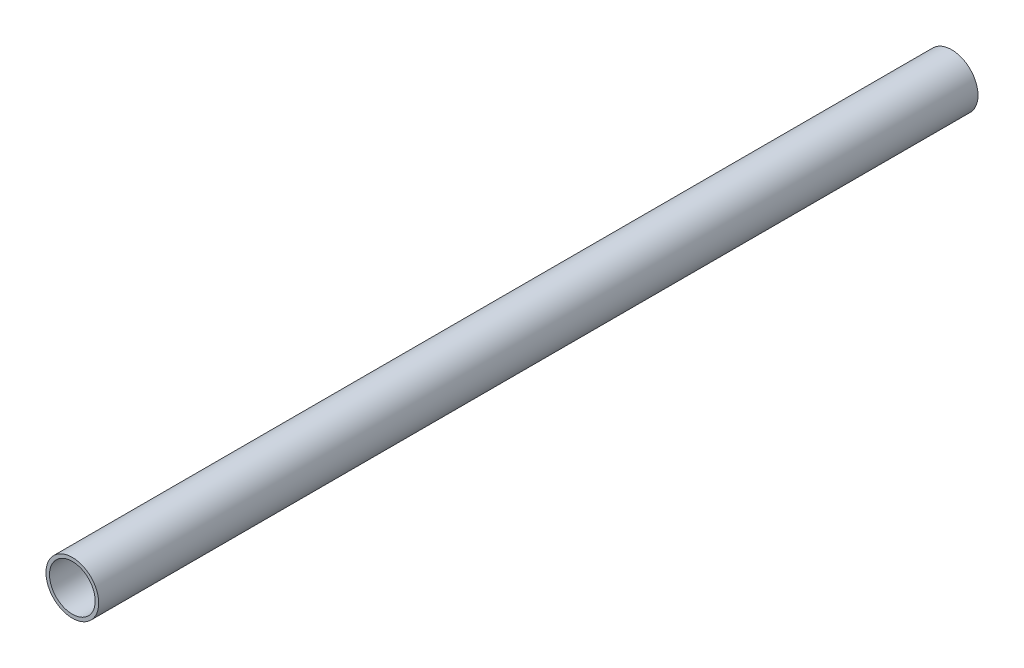
from build123d import *

# Parameters (mm, degrees)
SKETCH1_R           = 1.5
SKETCH1_R_2         = 1.3
BOSS_EXTRUDE1_DEPTH = 50


with BuildPart() as part:
    # Sketch1 → Boss-Extrude1 (new body)
    with BuildSketch(Plane.XY):
        Circle(SKETCH1_R)
        Circle(SKETCH1_R_2, mode=Mode.SUBTRACT)
    extrude(amount=BOSS_EXTRUDE1_DEPTH)


solid = part.part
